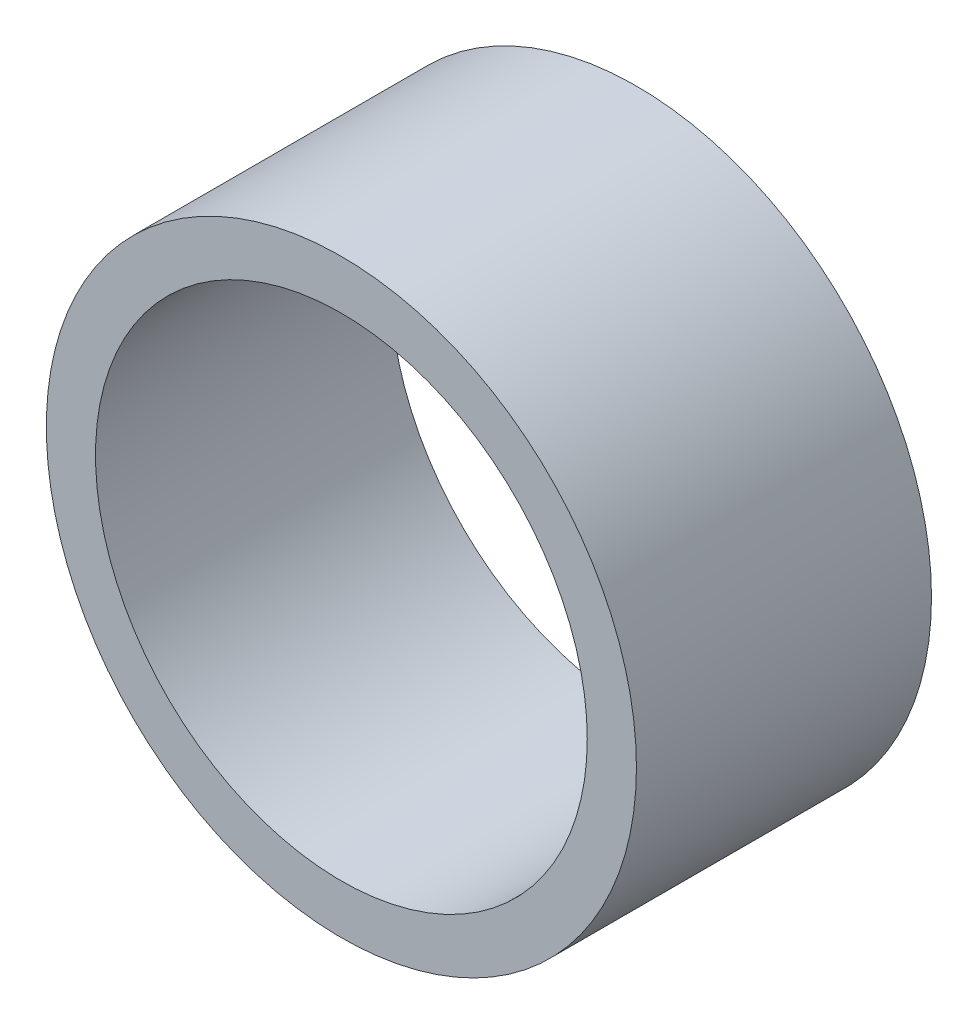
from build123d import *

# Parameters (mm, degrees)
SKETCH_1_R      = 6
SKETCH_1_R_2    = 5
EXTRUDE_1_DEPTH = 6


with BuildPart() as part:
    # 草图1 → 凸台-拉伸1 (new body)
    with BuildSketch(Plane.XY):
        Circle(SKETCH_1_R)
        Circle(SKETCH_1_R_2, mode=Mode.SUBTRACT)
    extrude(amount=EXTRUDE_1_DEPTH)


solid = part.part
